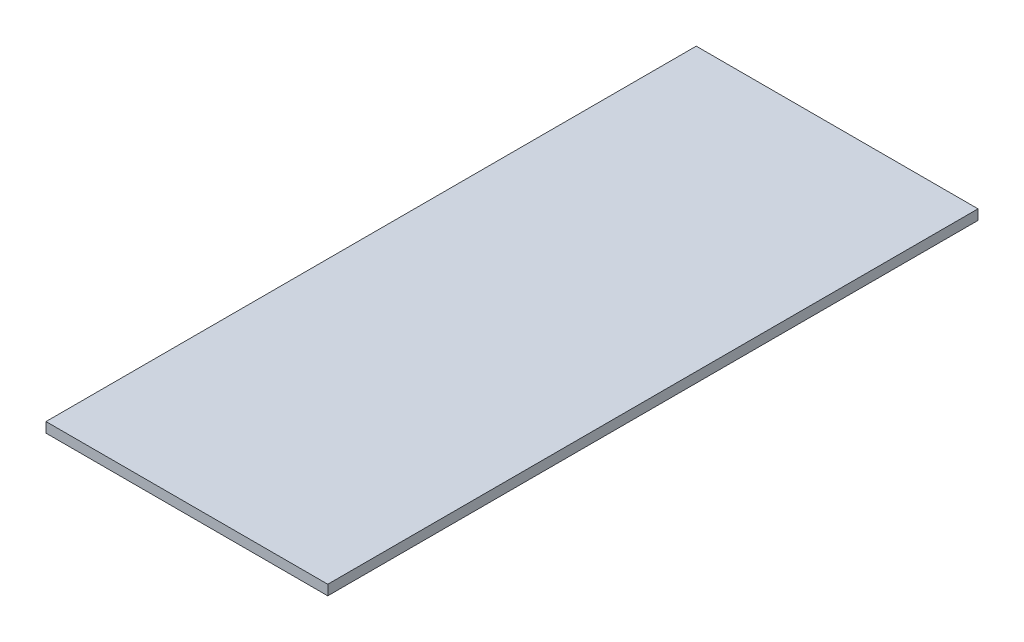
from build123d import *

# Parameters (mm, degrees)
SKETCH1_W           = 66.04
SKETCH1_H           = 152.4
BOSS_EXTRUDE1_DEPTH = 2.3622


with BuildPart() as part:
    # Sketch1 → Boss-Extrude1 (new body)
    with BuildSketch(Plane(origin=(0, 0, 0), x_dir=(1, 0, 0), z_dir=(0, 1, 0))):
        with Locations((33.02, 76.2)):
            Rectangle(SKETCH1_W, SKETCH1_H)
    extrude(amount=BOSS_EXTRUDE1_DEPTH)


solid = part.part
